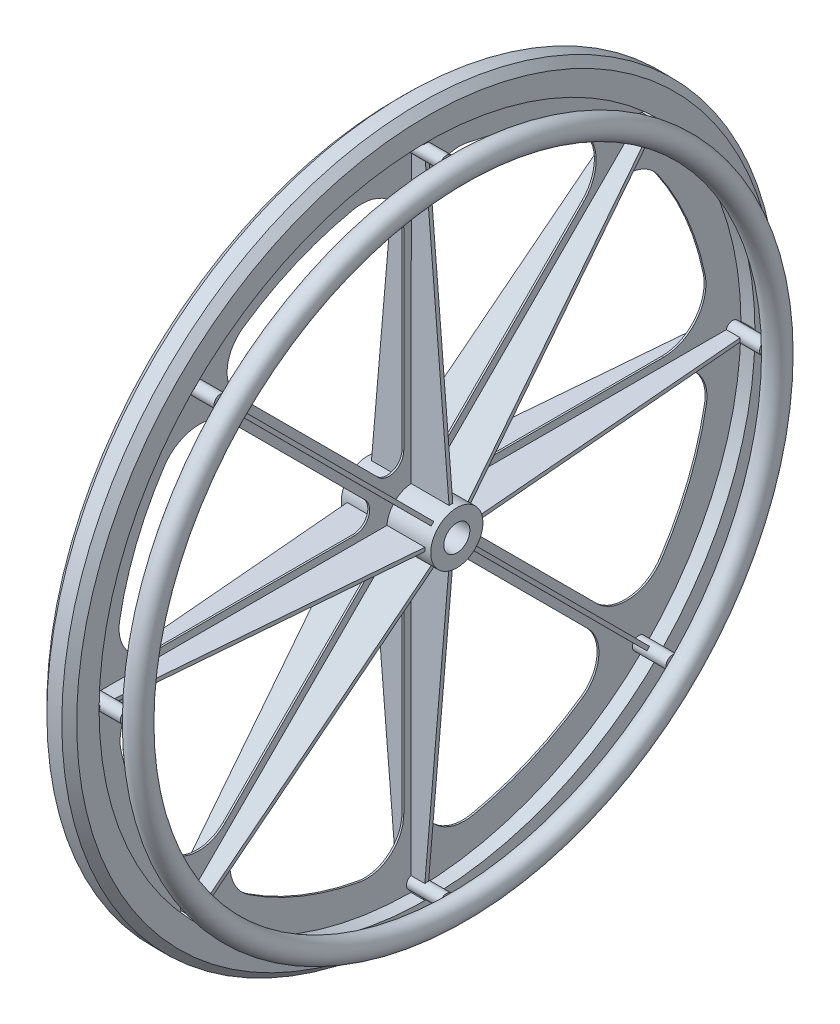
from build123d import *

# Parameters (mm, degrees)
BOSS_EXTRUDE1_DEPTH      = 38.1
BOSS_EXTRUDE1_DEPTH_BACK = 38.1
SKETCH1_R                = 22.225
BOSS_EXTRUDE2_DEPTH      = 0.762
BOSS_EXTRUDE2_DEPTH_BACK = 0.762
SKETCH2_R                = 304.8
BOSS_EXTRUDE3_DEPTH      = 12.7
BOSS_EXTRUDE3_DEPTH_BACK = 12.7
SKETCH4_R                = 304.8
SKETCH4_R_2              = 279.4
CUT_EXTRUDE3_DEPTH       = 433.73281595
SKETCH8_R                = 5.565
BOSS_EXTRUDE4_DEPTH      = 28.575
CIRPATTERN1_COUNT        = 8
SKETCH10_R               = 11.1125
CUT_EXTRUDE4_DEPTH       = 438.735673684
SKETCH11_R               = 9.525
CHAMFER1_SIZE            = 6.35


with BuildPart() as part:
    # Sketch1 → Boss-Extrude1 (new, two sides: drawn at the far end of the back side and taken through both)
    with BuildSketch(Plane(origin=(0, 0, 0), x_dir=(0, 0, -1), z_dir=(1, 0, 0)).offset(-BOSS_EXTRUDE1_DEPTH_BACK)):
        Circle(SKETCH1_R)
    extrude(amount=BOSS_EXTRUDE1_DEPTH + BOSS_EXTRUDE1_DEPTH_BACK)

    # Sketch2 → Boss-Extrude2 (add, two sides: drawn at the far end of the back side and taken through both)
    with BuildSketch(Plane(origin=(0, 0, 0), x_dir=(0, 0, -1), z_dir=(1, 0, 0)).offset(-BOSS_EXTRUDE2_DEPTH_BACK)):
        Circle(SKETCH2_R)
    extrude(amount=BOSS_EXTRUDE2_DEPTH + BOSS_EXTRUDE2_DEPTH_BACK)

    # Sketch4 → Boss-Extrude3 (add, two sides: drawn at the far end of the back side and taken through both)
    with BuildSketch(Plane(origin=(0, 0, 0), x_dir=(0, 0, -1), z_dir=(1, 0, 0)).offset(-BOSS_EXTRUDE3_DEPTH_BACK)):
        Circle(SKETCH4_R)
        Circle(SKETCH4_R_2, mode=Mode.SUBTRACT)
    extrude(amount=BOSS_EXTRUDE3_DEPTH + BOSS_EXTRUDE3_DEPTH_BACK)

    # Sketch5 → Cut-Extrude3 (cut, symmetric)
    with BuildSketch(Plane(origin=(0, 0, 0), x_dir=(0, 0, -1), z_dir=(1, 0, 0))):
        with BuildLine():
            Line((7.87, 218.690004573), (7.87, 49.660372978))
            ThreePointArc((7.87, 49.660372978), (15.709920409, 37.927102915), (29.550256121, 40.680116857))
            Line((29.550256121, 40.680116857), (145.521835922, 156.651696658))
            ThreePointArc((145.521835922, 156.651696658), (155.852250339, 185.653086438), (139.912523403, 211.991711618))
            ThreePointArc((139.912523403, 211.991711618), (94.519433509, 235.758513503), (45.28, 249.931433797))
            ThreePointArc((45.28, 249.931433797), (19.268617983, 243.059734772), (7.87, 218.690004573))
        make_face()
    cut_extrude3 = extrude(amount=CUT_EXTRUDE3_DEPTH, both=True, mode=Mode.SUBTRACT)

    # Sketch6 → Loft2 section 0
    with BuildSketch(Plane(origin=(0, 0, 0), x_dir=(1, 0, 0), z_dir=(0, 1, 0))):
        with BuildLine():
            Line((-34.925, -1.61147186), (34.925, -1.61147186))
            Line((34.925, -1.61147186), (34.925, 1.56352814))
            Line((34.925, 1.56352814), (-34.925, 1.56352814))
            Line((-34.925, 1.56352814), (-34.925, -1.61147186))
        make_face()
    # Sketch7 → Loft2 section 1
    with BuildSketch(Plane(origin=(0, 281.94, 0), x_dir=(1, 0, 0), z_dir=(0, 1, 0))):
        with BuildLine():
            Line((11.367260442, -1.422393186), (-10.857739558, -1.422393186))
            Line((-10.857739558, -1.422393186), (-10.857739558, 1.752606814))
            Line((-10.857739558, 1.752606814), (11.367260442, 1.752606814))
            Line((11.367260442, 1.752606814), (11.367260442, -1.422393186))
        make_face()
    loft2 = loft()

    # Sketch8 → Boss-Extrude4 (add)
    with BuildSketch(Plane(origin=(0.762, 0, 0), x_dir=(0, 0, -1), z_dir=(1, 0, 0))):
        with Locations((0, 272.265)):
            Circle(SKETCH8_R)
    boss_extrude4 = extrude(amount=BOSS_EXTRUDE4_DEPTH)

    # CirPattern1: Cut-Extrude3, Loft2, Boss-Extrude4 ×8 about axis
    cirpattern1_axis = Axis((12.7, 0, 0), (1, 0, 0))
    add([cut_extrude3.rotate(cirpattern1_axis, i * 360 / CIRPATTERN1_COUNT) for i in range(1, CIRPATTERN1_COUNT)], mode=Mode.SUBTRACT)
    add([loft2.rotate(cirpattern1_axis, i * 360 / CIRPATTERN1_COUNT) for i in range(1, CIRPATTERN1_COUNT)])
    add([boss_extrude4.rotate(cirpattern1_axis, i * 360 / CIRPATTERN1_COUNT) for i in range(1, CIRPATTERN1_COUNT)])

    # Sketch10 → Cut-Extrude4 (cut, through all)
    with BuildSketch(Plane.ZY.offset(38.1)):
        Circle(SKETCH10_R)
    extrude(amount=-CUT_EXTRUDE4_DEPTH, mode=Mode.SUBTRACT)

    # Chamfer1
    chamfer1_edges = [part.edges().sort_by_distance(p)[0] for p in [
        (12.7, 0, 304.8),
        (-12.7, 0, 304.8),
    ]]
    chamfer(chamfer1_edges, length=CHAMFER1_SIZE)


with BuildPart() as body_2:
    # Sketch11 → Revolve1 (revolve)
    with BuildSketch(Plane.XY):
        with Locations((38.862, 272.291748135)):
            Circle(SKETCH11_R)
    revolve(axis=Axis((-42.42435, 0, 0), (1, 0, 0)))


solid = Compound([part.part, body_2.part])
